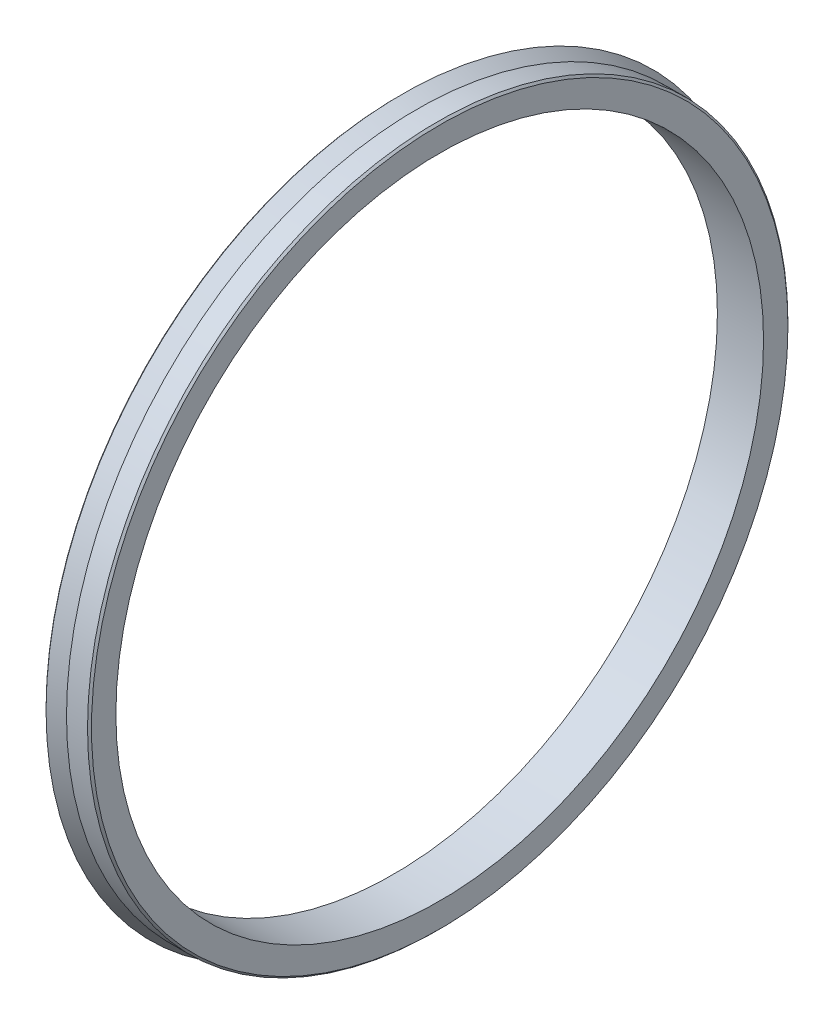
from build123d import *

# Parameters (mm, degrees)
CHAMFER1_SIZE  = 0.3
CHAMFER2_SIZE  = 0.3
CHAMFER2_SIZE2 = 0.234981042


with BuildPart() as part:
    # Sketch1 → Revolve2 (revolve)
    with BuildSketch(Plane.XY, mode=Mode.PRIVATE) as revolve2_sk:
        with BuildLine():
            Line((0, 0), (7, 0))
            Line((7, 0), (7, 4))
            Line((7, 4), (3.51, 4))
            Line((3.51, 4), (1, 4.89))
            Line((1, 4.89), (1, 4.3766025))
            ThreePointArc((1, 4.3766025), (1.086926266, 4.094875522), (1.317480361, 3.911106441))
            Line((1.317480361, 3.911106441), (4.292031423, 2.744793695))
            ThreePointArc((4.292031423, 2.744793695), (4.786077272, 1.851398109), (4, 1.2))
            Line((4, 1.2), (0, 1))
            Line((0, 1), (0, 0))
        make_face()
    revolve(revolve2_sk.sketch.rotate(Axis((7, -49.11, 0), (-1, 0, 0)), 90), axis=Axis((7, -49.11, 0), (-1, 0, 0)))

    # Chamfer1
    chamfer1_edges = [part.edges().sort_by_distance(p)[0] for p in [
        (7, -49.11, 53.11),
    ]]
    chamfer(chamfer1_edges, length=CHAMFER1_SIZE)

    # Chamfer2
    chamfer2_edges = [part.edges().sort_by_distance(p)[0] for p in [
        (1, -49.11, 54),
    ]]
    chamfer2_side = [part.faces().sort_by_distance(p)[0] for p in [
        (1, -49.11, 53.847264935),
    ]]
    chamfer(chamfer2_edges, length=CHAMFER2_SIZE, length2=CHAMFER2_SIZE2, reference=chamfer2_side[0])


solid = part.part
